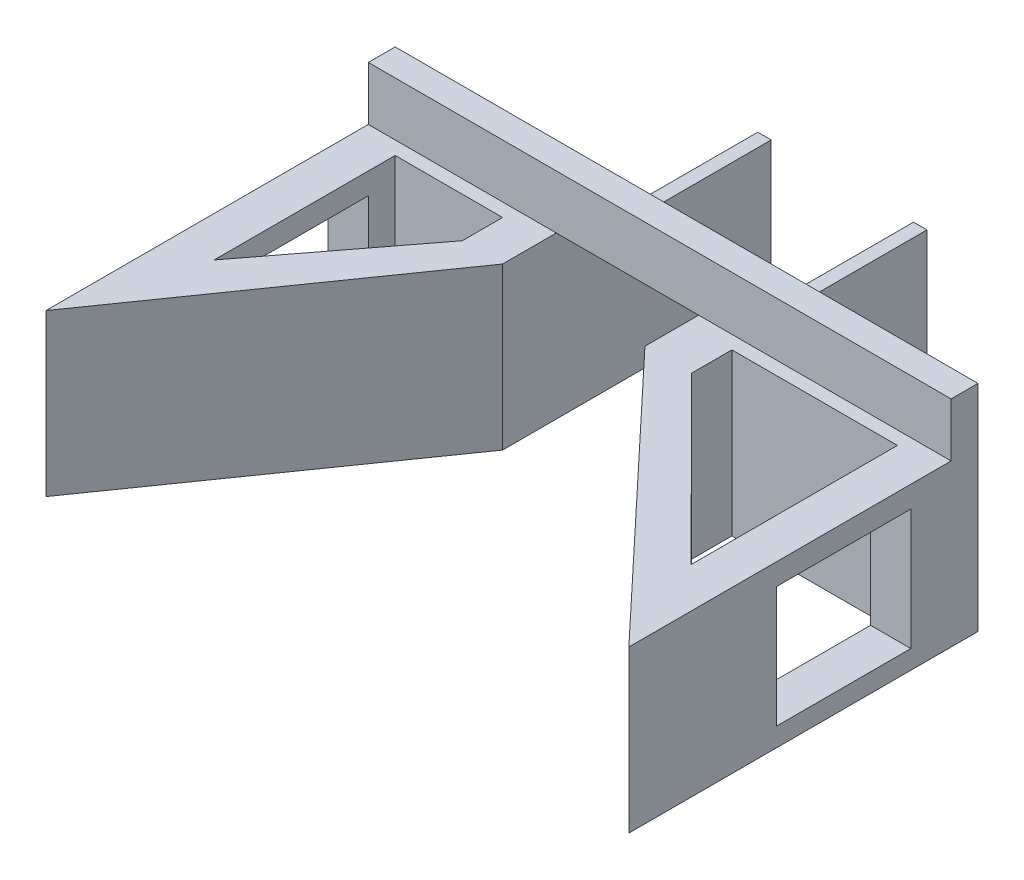
from build123d import *

# Parameters (mm, degrees)
BOSS_EXTRUDE1_DEPTH   = 60
BOSS_EXTRUDE1_2_DEPTH = 60
SKETCH3_W             = 217
SKETCH3_H             = 10
BOSS_EXTRUDE3_DEPTH   = 20
SKETCH4_W             = 5
SKETCH4_H             = 70
BOSS_EXTRUDE4_DEPTH   = 50
SKETCH5_W             = 5
SKETCH5_H             = 70
BOSS_EXTRUDE5_DEPTH   = 50
SKETCH6_W             = 50
SKETCH6_H             = 45
CUT_EXTRUDE1_DEPTH    = 30
SKETCH7_W             = 50
SKETCH7_H             = 45
CUT_EXTRUDE2_DEPTH    = 20


with BuildPart() as part:
    # Sketch1 → Boss-Extrude1 (new body)
    with BuildSketch(Plane(origin=(0, 0, 0), x_dir=(1, 0, 0), z_dir=(0, 1, 0))):
        Polygon((0, 42.700803213), (0, 27.700803213), (0, 12.700803213), (94, -87.299196787), (94, 42.700803213), align=None)
        Polygon((79, -49.143729641), (79, 27.700803213), (17.378559694, 27.700803213), (17.378559694, 12.700803213), align=None, mode=Mode.SUBTRACT)
    extrude(amount=BOSS_EXTRUDE1_DEPTH)



with BuildPart() as body_2:
    # Sketch1 → Boss-Extrude1 2 (new body)
    with BuildSketch(Plane(origin=(0, 0, 0), x_dir=(1, 0, 0), z_dir=(0, 1, 0))):
        Polygon((-123, 12.700803213), (-123, -87.299196787), (-53, 12.700803213), (-53, 42.700803213), (-123, 42.700803213), align=None)
        Polygon((-108, 27.700803213), (-108, -39.713720468), (-68, 12.700803213), (-68, 27.700803213), align=None, mode=Mode.SUBTRACT)
    extrude(amount=BOSS_EXTRUDE1_2_DEPTH)

    # Sketch3 → Boss-Extrude3 (add)
    with BuildSketch(Plane(origin=(0, 60, 0), x_dir=(1, 0, 0), z_dir=(0, 1, 0))):
        with Locations((-14.5, 37.700803213)):
            Rectangle(SKETCH3_W, SKETCH3_H)
    extrude(amount=BOSS_EXTRUDE3_DEPTH)

    # Sketch4 → Boss-Extrude4 (add)
    with BuildSketch(Plane(origin=(0, 0, 0), x_dir=(-1, 0, 0), z_dir=(0, -1, 0))):
        with Locations((55.5, 77.700803213)):
            Rectangle(SKETCH4_W, SKETCH4_H)
    extrude(amount=-BOSS_EXTRUDE4_DEPTH)


with BuildPart() as part_1:
    add(part.part)

    add(body_2.part)  # Boss-Extrude5 merges body 2
    # Sketch5 → Boss-Extrude5 (add)
    with BuildSketch(Plane(origin=(0, 0, 0), x_dir=(-1, 0, 0), z_dir=(0, -1, 0))):
        with Locations((-2.5, 77.700803213)):
            Rectangle(SKETCH5_W, SKETCH5_H)
    extrude(amount=-BOSS_EXTRUDE5_DEPTH)

    # Sketch6 → Cut-Extrude1 (cut)
    with BuildSketch(Plane(origin=(94, 0, 0), x_dir=(0, 0, -1), z_dir=(1, 0, 0))):
        with Locations((-7.299196787, 29.5)):
            Rectangle(SKETCH6_W, SKETCH6_H)
    extrude(amount=-CUT_EXTRUDE1_DEPTH, mode=Mode.SUBTRACT)

    # Sketch7 → Cut-Extrude2 (cut)
    with BuildSketch(Plane.ZY.offset(123)):
        with Locations((7.299196787, 29.5)):
            Rectangle(SKETCH7_W, SKETCH7_H)
    extrude(amount=-CUT_EXTRUDE2_DEPTH, mode=Mode.SUBTRACT)


solid = part_1.part
